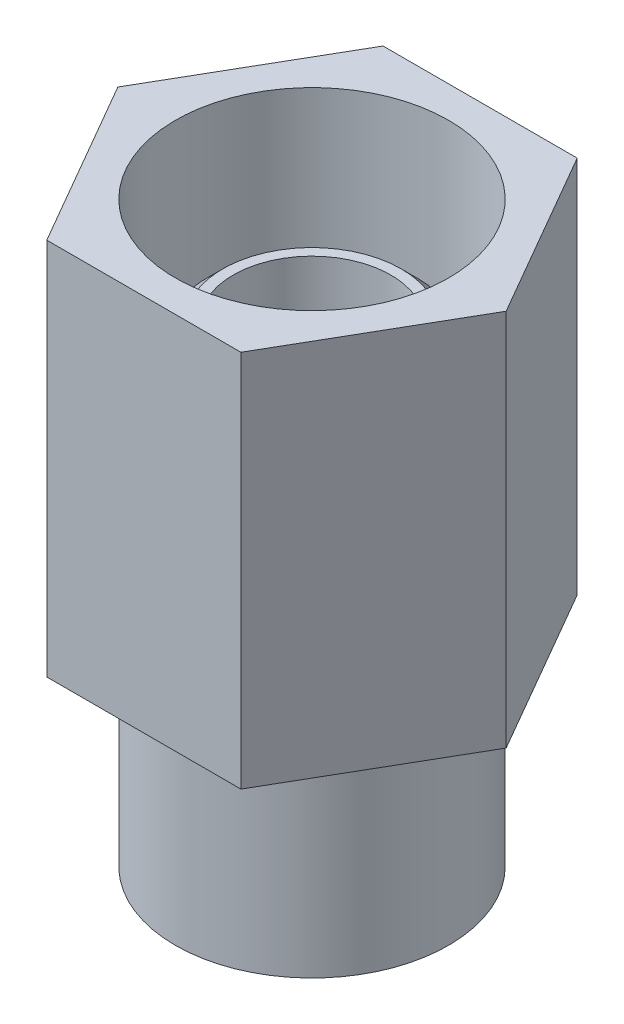
from build123d import *

# Parameters (mm, degrees)
SZKIC1_R                    = 13
SZKIC1_R_2                  = 7.5
DODANIE_WYCI_GNI_CIE1_DEPTH = 19
SFAZOWANIE1_SIZE            = 4.5
DODANIE_WYCI_GNI_CIE2_START = 19
SZKIC1_3_R                  = 7.5
DODANIE_WYCI_GNI_CIE2_DEPTH = 16
DODANIE_WYCI_GNI_CIE3_START = 29
SZKIC2_R                    = 13
DODANIE_WYCI_GNI_CIE3_DEPTH = 26
DODANIE_WYCI_GNI_CIE4_START = 29
SZKIC2_3_R                  = 10
SZKIC2_3_R_2                = 7.5
DODANIE_WYCI_GNI_CIE4_DEPTH = 16
SFAZOWANIE2_SIZE            = 1.5


with BuildPart() as part:
    # Szkic1 → Dodanie-wyciągnięcie1 (new body)
    with BuildSketch(Plane(origin=(0, 0, 0), x_dir=(1, 0, 0), z_dir=(0, 1, 0))):
        Circle(SZKIC1_R)
        Circle(SZKIC1_R_2, mode=Mode.SUBTRACT)
    extrude(amount=DODANIE_WYCI_GNI_CIE1_DEPTH)

    # Sfazowanie1
    sfazowanie1_edges = [part.edges().sort_by_distance(p)[0] for p in [
        (-7.5, 0, 0),
    ]]
    chamfer(sfazowanie1_edges, length=SFAZOWANIE1_SIZE)

    # Szkic1<3> → Dodanie-wyciągnięcie2 (add)
    with BuildSketch(Plane(origin=(0, 0, 0), x_dir=(1, 0, 0), z_dir=(0, 1, 0)).offset(DODANIE_WYCI_GNI_CIE2_START)):
        Polygon((-18.475208614, 0), (-9.237604307, -16), (9.237604307, -16), (18.475208614, 0), (9.237604307, 16), (-9.237604307, 16), align=None)
        Circle(SZKIC1_3_R, mode=Mode.SUBTRACT)
    extrude(amount=DODANIE_WYCI_GNI_CIE2_DEPTH)

    # Szkic2 → Dodanie-wyciągnięcie3 (add)
    with BuildSketch(Plane(origin=(0, 0, 0), x_dir=(1, 0, 0), z_dir=(0, 1, 0)).offset(DODANIE_WYCI_GNI_CIE3_START)):
        Polygon((-9.237604307, 16), (-18.475208614, 0), (-9.237604307, -16), (9.237604307, -16), (18.475208614, 0), (9.237604307, 16), align=None)
        Circle(SZKIC2_R, mode=Mode.SUBTRACT)
    extrude(amount=DODANIE_WYCI_GNI_CIE3_DEPTH)

    # Szkic2<3> → Dodanie-wyciągnięcie4 (add)
    with BuildSketch(Plane(origin=(0, 0, 0), x_dir=(1, 0, 0), z_dir=(0, 1, 0)).offset(DODANIE_WYCI_GNI_CIE4_START)):
        Circle(SZKIC2_3_R)
        Circle(SZKIC2_3_R_2, mode=Mode.SUBTRACT)
    extrude(amount=DODANIE_WYCI_GNI_CIE4_DEPTH)

    # Sfazowanie2
    sfazowanie2_edges = [part.edges().sort_by_distance(p)[0] for p in [
        (-10, 45, 0),
    ]]
    chamfer(sfazowanie2_edges, length=SFAZOWANIE2_SIZE)


solid = part.part
